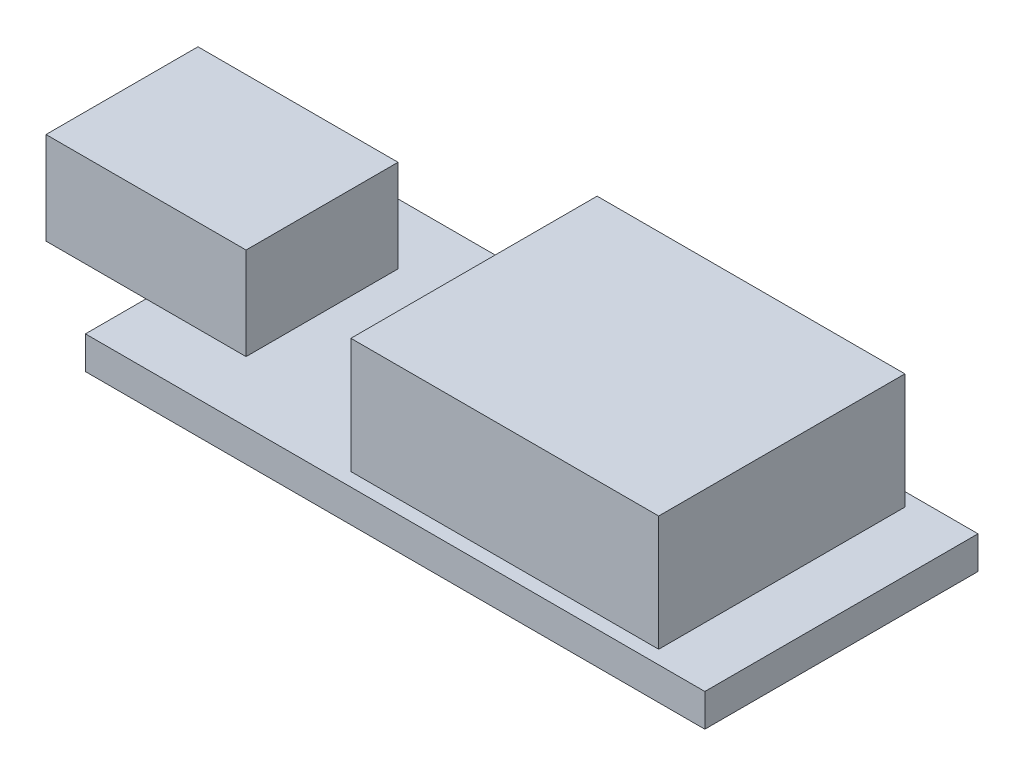
from build123d import *

# Parameters (mm, degrees)
SKETCH1_W           = 32.2
SKETCH1_H           = 14.2
SKETCH1_R           = 1.35
BOSS_EXTRUDE1_DEPTH = 1.7
SKETCH2_W           = 16
SKETCH2_H           = 12.8
BOSS_EXTRUDE2_DEPTH = 6
SKETCH3_W           = 10.4
SKETCH3_H           = 7.9
BOSS_EXTRUDE3_DEPTH = 4.8


with BuildPart() as part:
    # Sketch1 → Boss-Extrude1 (new body)
    with BuildSketch(Plane(origin=(0, 0, 0), x_dir=(1, 0, 0), z_dir=(0, 1, 0))):
        Rectangle(SKETCH1_W, SKETCH1_H)
        with Locations(Location((-5.95, 0, 0), (0, 0, 270))):
            Circle(SKETCH1_R, mode=Mode.SUBTRACT)
    extrude(amount=BOSS_EXTRUDE1_DEPTH)

    # Sketch2 → Boss-Extrude2 (add)
    with BuildSketch(Plane(origin=(0, 1.7, 0), x_dir=(1, 0, 0), z_dir=(0, 1, 0))):
        with Locations((5, 0)):
            Rectangle(SKETCH2_W, SKETCH2_H)
    extrude(amount=BOSS_EXTRUDE2_DEPTH)

    # Sketch3 → Boss-Extrude3 (add)
    with BuildSketch(Plane(origin=(0, 1.7, 0), x_dir=(1, 0, 0), z_dir=(0, 1, 0))):
        with Locations((-16.1, 0)):
            Rectangle(SKETCH3_W, SKETCH3_H)
    extrude(amount=BOSS_EXTRUDE3_DEPTH)


solid = part.part
